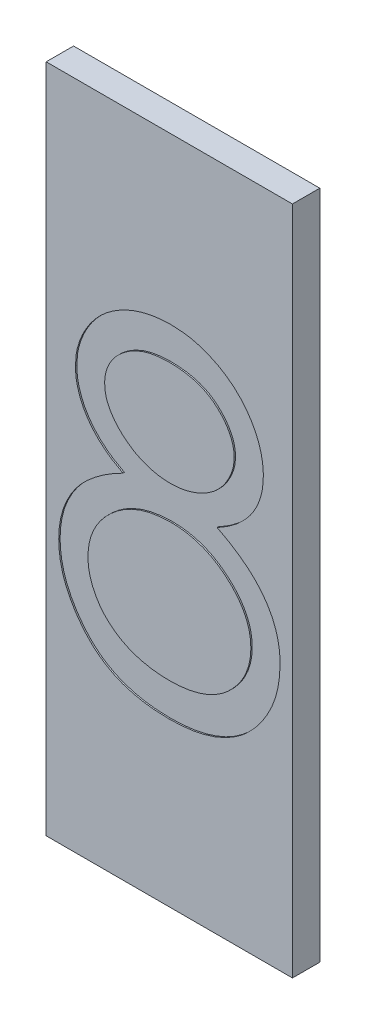
from build123d import *

# Parameters (mm, degrees)
SKETCH_1_W          = 18
SKETCH_1_H          = 49
EXTRUDE_1_DEPTH     = 2
CUT_EXTRUDE_1_DEPTH = 0.1


with BuildPart() as part:
    # ｽｹｯﾁ1 → ﾎﾞｽ - 押し出し1 (new body)
    with BuildSketch(Plane.XY):
        with Locations((9, 24.5)):
            Rectangle(SKETCH_1_W, SKETCH_1_H)
    extrude(amount=EXTRUDE_1_DEPTH)

    # ｽｹｯﾁ2 → ｶｯﾄ - 押し出し1 (cut)
    with BuildSketch(Plane.XY.offset(2)):
        with BuildLine():
            add(Edge.make_bspline(
                [(12.492976262, 25.76573768), (12.687888699, 25.66410623), (13.068033045, 25.46589096), (13.609442265, 25.146729793), (14.104232006, 24.810354657), (14.566130292, 24.472653542), (14.987022018, 24.120693557), (15.36220097, 23.753075119), (15.700934598, 23.378974313), (15.996391825, 22.992056293), (16.256266732, 22.593348984), (16.480867152, 22.181805894), (16.672844907, 21.758328927), (16.824992758, 21.318295495), (16.950326734, 20.868169429), (17.036566118, 20.402138517), (17.082945505, 19.923273626), (17.09171404, 19.599639288), (17.096153846, 19.435772236)],
                knots=[0, 0, 0, 0, 1.272397273, 2.481599622, 3.635517121, 4.734568067, 5.792894095, 6.808321871, 7.773003508, 8.711915296, 9.623354172, 10.525449501, 11.423591555, 12.311487226, 13.218079475, 14.126165749, 15.051214107, 16, 16, 16, 16], degree=3))
            add(Edge.make_bspline(
                [(17.096153846, 19.435772236), (17.090905431, 19.206507305), (17.080516849, 18.752705983), (16.990029458, 18.082920831), (16.854550087, 17.432419243), (16.656705548, 16.801343833), (16.400119799, 16.193176846), (16.083911326, 15.607397691), (15.725967234, 15.034405605), (15.438501106, 14.681848605), (15.29304387, 14.503455529)],
                knots=[0, 0, 0, 0, 1.025265484, 2.029385089, 3.018602448, 3.995076438, 4.983346944, 5.966715145, 6.97116228, 8, 8, 8, 8], degree=3))
            add(Edge.make_bspline(
                [(15.29304387, 14.503455529), (15.103656429, 14.295308601), (14.72722186, 13.881586874), (14.082359441, 13.344439399), (13.374639125, 12.893026557), (12.606799397, 12.52514456), (11.780892761, 12.238810413), (10.897095194, 12.033053282), (9.953683725, 11.915198898), (9.305266145, 11.898162825), (8.97261869, 11.889423077)],
                knots=[0, 0, 0, 0, 0.954267603, 1.896743057, 2.838368354, 3.796610408, 4.779680527, 5.799409237, 6.871065594, 8, 8, 8, 8], degree=3))
            add(Edge.make_bspline(
                [(8.97261869, 11.889423077), (8.652759742, 11.897264043), (8.030346719, 11.912521767), (7.124397588, 12.015898167), (6.279917417, 12.19706276), (5.491996025, 12.445016263), (4.765383486, 12.767575138), (4.102150245, 13.169043061), (3.492727326, 13.633260552), (2.955609354, 14.173559905), (2.47875762, 14.752257215), (2.059874973, 15.34928156), (1.711708475, 15.964687439), (1.416929487, 16.589298616), (1.191268475, 17.231869772), (1.034975402, 17.889094861), (0.935715961, 18.559825922), (0.922509311, 19.012478778), (0.915865385, 19.240196815)],
                knots=[0, 0, 0, 0, 1.256902934, 2.445805442, 3.576955095, 4.645999104, 5.686449165, 6.692658513, 7.68621702, 8.689161843, 9.678783111, 10.630372946, 11.551080876, 12.453998257, 13.34127905, 14.221779781, 15.105423033, 16, 16, 16, 16], degree=3))
            add(Edge.make_bspline(
                [(0.915865385, 19.240196815), (0.919797039, 19.407287032), (0.927567377, 19.737516278), (0.981348577, 20.225395815), (1.067811501, 20.700258803), (1.185237448, 21.16385922), (1.344379967, 21.612821949), (1.536527338, 22.049274279), (1.760582229, 22.473708952), (2.019670155, 22.888447054), (2.32108214, 23.287677306), (2.662374114, 23.678175055), (3.050367292, 24.053880973), (3.480745293, 24.419385328), (3.948589749, 24.781171864), (4.46605259, 25.119688518), (5.019416091, 25.458900743), (5.412699297, 25.661703814), (5.614445613, 25.76573768)],
                knots=[0, 0, 0, 0, 0.941657376, 1.861047343, 2.762797495, 3.66048619, 4.553285746, 5.444104102, 6.34607688, 7.256116206, 8.197091036, 9.162375105, 10.176350973, 11.237807142, 12.343728897, 13.50695164, 14.721116704, 16, 16, 16, 16], degree=3))
            add(Edge.make_bspline(
                [(5.614445613, 25.76573768), (5.338279296, 25.91633316), (4.803544008, 26.207928159), (4.095500131, 26.743687679), (3.48732464, 27.323949419), (2.995734507, 27.960966416), (2.608800241, 28.6348389), (2.343334378, 29.341350689), (2.163744014, 30.06740139), (2.145953851, 30.563423906), (2.137019231, 30.81253756)],
                knots=[0, 0, 0, 0, 1.166880483, 2.259407225, 3.286803203, 4.280235371, 5.237608625, 6.161067461, 7.076446754, 8, 8, 8, 8], degree=3))
            add(Edge.make_bspline(
                [(2.137019231, 30.81253756), (2.148145955, 31.066294163), (2.170512612, 31.576389188), (2.351374133, 32.33570942), (2.6461053, 33.08149355), (3.046978512, 33.810126882), (3.546273679, 34.496948878), (4.145304642, 35.112950673), (4.829766358, 35.652552009), (5.596242203, 36.105507756), (6.421081593, 36.474150149), (7.291365357, 36.728456918), (8.191930248, 36.894709784), (8.804916517, 36.913532916), (9.115722656, 36.923076923)],
                knots=[0, 0, 0, 0, 0.888701115, 1.786444228, 2.72001202, 3.692817113, 4.693886446, 5.687152267, 6.695133018, 7.739871481, 8.800368666, 9.853104506, 10.91144658, 12, 12, 12, 12], degree=3))
            add(Edge.make_bspline(
                [(9.115722656, 36.923076923), (9.41850754, 36.913236624), (10.015564838, 36.893832676), (10.893189, 36.731996953), (11.73291897, 36.461694327), (12.531858954, 36.095000718), (13.275706124, 35.643332425), (13.932946835, 35.096319335), (14.513513151, 34.483034856), (14.993739119, 33.796421126), (15.389454492, 33.070587595), (15.665005266, 32.311155801), (15.841571374, 31.534534525), (15.863841941, 31.009040249), (15.875, 30.745755709)],
                knots=[0, 0, 0, 0, 1.072916533, 2.115669174, 3.151510826, 4.193348718, 5.225979165, 6.227137561, 7.216255879, 8.211077061, 9.189680878, 10.138522389, 11.067357538, 12, 12, 12, 12], degree=3))
            add(Edge.make_bspline(
                [(15.875, 30.745755709), (15.865239864, 30.487378764), (15.846071512, 29.979941129), (15.684827281, 29.240212481), (15.413274201, 28.547458966), (15.042519271, 27.893819773), (14.559292293, 27.291149227), (13.970043592, 26.731783602), (13.279471034, 26.211127859), (12.760624648, 25.917306345), (12.492976262, 25.76573768)],
                knots=[0, 0, 0, 0, 0.975232327, 1.915300861, 2.843280834, 3.77672583, 4.742871857, 5.749627742, 6.839139064, 8, 8, 8, 8], degree=3))
        make_face()
        with BuildLine():
            add(Edge.make_bspline(
                [(8.996469351, 34.480769231), (8.82943619, 34.476337108), (8.502646291, 34.467665939), (8.023479796, 34.422363427), (7.567828511, 34.334235291), (7.130931725, 34.216950486), (6.718779449, 34.058508995), (6.325774176, 33.872125093), (5.958604545, 33.645524897), (5.61283818, 33.391335318), (5.301569518, 33.111756797), (5.02531355, 32.820470603), (4.795841916, 32.511755882), (4.600980082, 32.193291863), (4.459591543, 31.855626693), (4.35369869, 31.509112796), (4.282115652, 31.149371344), (4.276751784, 30.903514013), (4.274038462, 30.779146635)],
                knots=[0, 0, 0, 0, 1.203892937, 2.355340988, 3.463153438, 4.544400666, 5.610487187, 6.640501085, 7.674077295, 8.714426146, 9.728707835, 10.68524104, 11.601827946, 12.495867327, 13.368432065, 14.231010473, 15.105153427, 16, 16, 16, 16], degree=3))
            add(Edge.make_bspline(
                [(4.274038462, 30.779146635), (4.278715011, 30.654773882), (4.287956546, 30.408995457), (4.359428935, 30.046053047), (4.465951465, 29.689398697), (4.633664, 29.347513034), (4.834820831, 29.008536251), (5.083093195, 28.6809403), (5.378973903, 28.363585092), (5.712535595, 28.059169894), (6.075924807, 27.774108667), (6.460898387, 27.526641128), (6.862624729, 27.319580484), (7.276976307, 27.147250069), (7.7081761, 27.013288174), (8.153581929, 26.91825149), (8.61326865, 26.859182905), (8.924740101, 26.852127456), (9.082331731, 26.848557692)],
                knots=[0, 0, 0, 0, 0.873023192, 1.725219244, 2.590779336, 3.480155217, 4.391973325, 5.357036234, 6.360879153, 7.436073238, 8.526419356, 9.601555421, 10.645666583, 11.697338044, 12.750135903, 13.812665442, 14.89329948, 16, 16, 16, 16], degree=3))
            add(Edge.make_bspline(
                [(9.082331731, 26.848557692), (9.284738687, 26.854496306), (9.687553438, 26.866314879), (10.281364605, 26.976200543), (10.858733668, 27.149051519), (11.413489428, 27.385543433), (11.93127241, 27.682368693), (12.39282716, 28.037739763), (12.794216734, 28.443450996), (13.131269815, 28.89318636), (13.392593948, 29.371828416), (13.596033034, 29.852162551), (13.714831659, 30.339313444), (13.730327249, 30.665660109), (13.737980769, 30.826847957)],
                knots=[0, 0, 0, 0, 1.076279235, 2.141928126, 3.20205304, 4.278698113, 5.344010996, 6.36967002, 7.368914609, 8.37248503, 9.349703398, 10.264243087, 11.142681841, 12, 12, 12, 12], degree=3))
            add(Edge.make_bspline(
                [(13.737980769, 30.826847957), (13.734361966, 30.939977987), (13.72717916, 31.164524881), (13.667987708, 31.496119831), (13.570180702, 31.820171105), (13.437762246, 32.139355697), (13.263524178, 32.44919532), (13.05693926, 32.754560615), (12.80599292, 33.048582151), (12.524349328, 33.338111865), (12.204952888, 33.606063883), (11.848419127, 33.841703608), (11.456575933, 34.041812677), (11.029414041, 34.204341527), (10.568506611, 34.326413584), (10.075976518, 34.417828736), (9.547716978, 34.46935294), (9.18420385, 34.476881266), (8.996469351, 34.480769231)],
                knots=[0, 0, 0, 0, 0.814439003, 1.616544685, 2.417341072, 3.248991801, 4.09997495, 4.973547432, 5.9003056, 6.880240646, 7.880314356, 8.896779544, 9.951930927, 11.043077905, 12.18215768, 13.381699519, 14.647792085, 16, 16, 16, 16], degree=3))
        make_face(mode=Mode.SUBTRACT)
        with BuildLine():
            add(Edge.make_bspline(
                [(9.134803185, 24.40625), (8.92303668, 24.402483261), (8.507602468, 24.395093839), (7.898975868, 24.31284206), (7.314867724, 24.198342082), (6.757247442, 24.024641199), (6.226350498, 23.798786506), (5.719302889, 23.527089011), (5.239983597, 23.205923406), (4.795011477, 22.839370005), (4.388679539, 22.444358362), (4.032183962, 22.026196336), (3.729441903, 21.592655532), (3.485647821, 21.138229829), (3.285543001, 20.67254162), (3.154139658, 20.183993516), (3.069899799, 19.681977621), (3.058587967, 19.340709809), (3.052884615, 19.168644832)],
                knots=[0, 0, 0, 0, 1.140299081, 2.23698856, 3.303958914, 4.344563908, 5.37730929, 6.408454204, 7.439741482, 8.480804886, 9.510774543, 10.48932336, 11.43758569, 12.353841022, 13.263987381, 14.161954604, 15.073269652, 16, 16, 16, 16], degree=3))
            add(Edge.make_bspline(
                [(3.052884615, 19.168644832), (3.062159644, 18.954802417), (3.080561084, 18.530544062), (3.226542858, 17.903506024), (3.460827484, 17.296484204), (3.787570471, 16.714425383), (4.192162348, 16.170479124), (4.689683497, 15.696346561), (5.249214911, 15.275059359), (5.889688525, 14.934332873), (6.589289338, 14.662225019), (7.34783128, 14.474746059), (8.154428137, 14.350639052), (8.71136572, 14.338132855), (8.996469351, 14.331730769)],
                knots=[0, 0, 0, 0, 0.898778495, 1.783155532, 2.693654817, 3.627872908, 4.583023416, 5.533784346, 6.509005473, 7.520592997, 8.575161974, 9.658835044, 10.801527049, 12, 12, 12, 12], degree=3))
            add(Edge.make_bspline(
                [(8.996469351, 14.331730769), (9.219288818, 14.336008912), (9.653412594, 14.344344107), (10.286729496, 14.41791993), (10.884386157, 14.534598627), (11.445223589, 14.704303823), (11.975520071, 14.911472413), (12.466284497, 15.177982468), (12.930141976, 15.48109738), (13.344235383, 15.840721623), (13.721379178, 16.2249839), (14.050218186, 16.631769729), (14.335679382, 17.050023585), (14.559727492, 17.489197418), (14.73884004, 17.940865533), (14.867587796, 18.409192851), (14.947027761, 18.895615775), (14.955062069, 19.22558267), (14.959134615, 19.392841046)],
                knots=[0, 0, 0, 0, 1.224942928, 2.386581632, 3.501229538, 4.569074225, 5.605009692, 6.626002462, 7.634866581, 8.645888296, 9.63523824, 10.59253846, 11.518950513, 12.414518923, 13.29783783, 14.186679152, 15.080837789, 16, 16, 16, 16], degree=3))
            add(Edge.make_bspline(
                [(14.959134615, 19.392841046), (14.95297161, 19.555292238), (14.940819241, 19.875617611), (14.863689251, 20.350279159), (14.728190158, 20.80885902), (14.542266262, 21.256874239), (14.294745784, 21.685247171), (14.00324765, 22.105137551), (13.651543022, 22.504891219), (13.254128751, 22.887613176), (12.821020465, 23.241505956), (12.360642212, 23.554568476), (11.876537747, 23.818221267), (11.369731473, 24.032645994), (10.841348726, 24.201289314), (10.291778143, 24.319099924), (9.720376286, 24.393256151), (9.332199398, 24.401869784), (9.134803185, 24.40625)],
                knots=[0, 0, 0, 0, 0.917430815, 1.809013306, 2.70690318, 3.612392954, 4.541220862, 5.495268465, 6.494511384, 7.542276156, 8.608045339, 9.649016899, 10.681629292, 11.715607085, 12.752076957, 13.808767841, 14.885711793, 16, 16, 16, 16], degree=3))
        make_face(mode=Mode.SUBTRACT)
    extrude(amount=-CUT_EXTRUDE_1_DEPTH, mode=Mode.SUBTRACT)


solid = part.part
